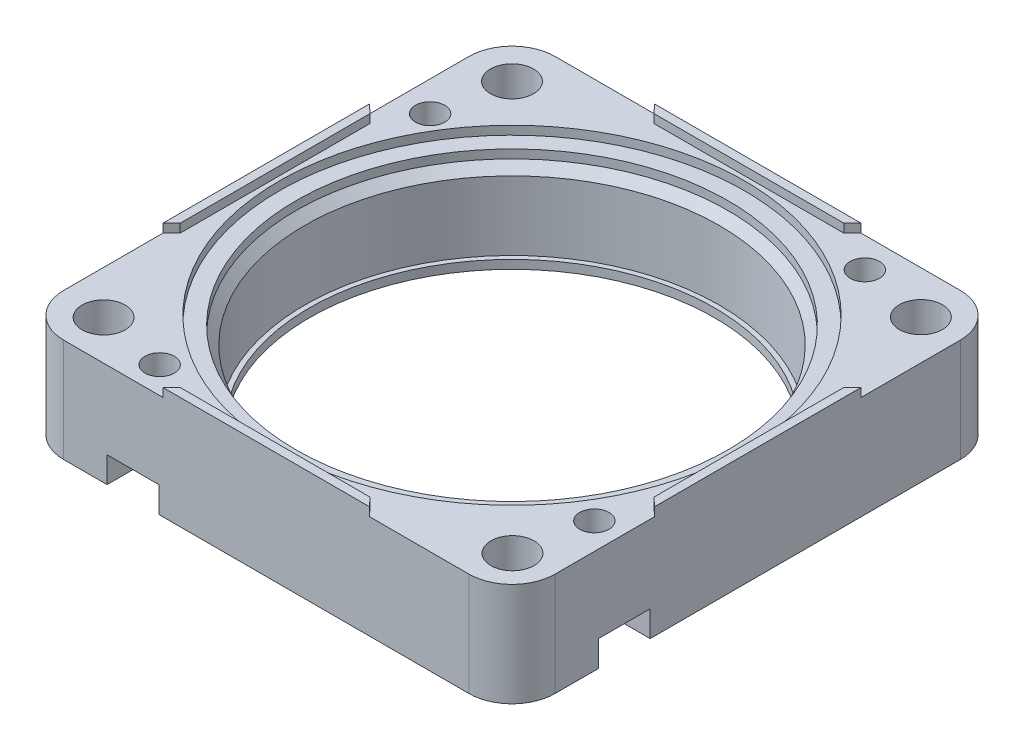
from build123d import *

# Parameters (mm, degrees)
SKETCH1_W           = 57
SKETCH1_H           = 57
BOSS_EXTRUDE1_DEPTH = 12
FILLET1_R           = 5
SKETCH2_R           = 2.5
SKETCH2_R_2         = 1.7
CUT_EXTRUDE1_DEPTH  = 43.053537307
CIRPATTERN2_COUNT   = 4
SKETCH3_R           = 27
CUT_EXTRUDE2_DEPTH  = 1
SKETCH4_R           = 25.05
CUT_EXTRUDE3_DEPTH  = 2
CHAMFER1_SIZE       = 1
SKETCH5_R           = 24.05
CUT_EXTRUDE4_DEPTH  = 8
SKETCH6_R           = 23.5
CUT_EXTRUDE5_DEPTH  = 2
BOSS_EXTRUDE2_DEPTH = 1
CIRPATTERN3_COUNT   = 4
CUT_EXTRUDE8_START  = -3
SKETCH9_R           = 3
SKETCH9_R_2         = 1.7
CUT_EXTRUDE8_DEPTH  = 3
CIRPATTERN6_COUNT   = 4


with BuildPart() as part:
    # Sketch1 → Boss-Extrude1 (new body)
    with BuildSketch(Plane(origin=(0, 0, 0), x_dir=(1, 0, 0), z_dir=(0, 1, 0))):
        Rectangle(SKETCH1_W, SKETCH1_H)
    extrude(amount=BOSS_EXTRUDE1_DEPTH)

    # Fillet1
    fillet1_edges = [part.edges().sort_by_distance(p)[0] for p in [
        (-28.5, 6, -28.5),
        (28.5, 6, -28.5),
        (28.5, 6, 28.5),
        (-28.5, 6, 28.5),
    ]]
    fillet(fillet1_edges, radius=FILLET1_R)

    # Sketch2 → Cut-Extrude1 (cut, through all)
    with BuildSketch(Plane(origin=(0, 12, 0), x_dir=(1, 0, 0), z_dir=(0, 1, 0))):
        with Locations(Location((-23.5, 23.5, 0), (0, 0, 270))):
            Circle(SKETCH2_R)
        with Locations(Location((-25, 15.5, 0), (0, 0, 270))):
            Circle(SKETCH2_R_2)
    cut_extrude1 = extrude(amount=-CUT_EXTRUDE1_DEPTH, mode=Mode.SUBTRACT)

    # CirPattern2: Cut-Extrude1 ×4 about axis
    cirpattern2_axis = Axis((0.215204442, 0, 0.188240663), (0, 1, 0))
    for i in range(1, CIRPATTERN2_COUNT):
        add(cut_extrude1.rotate(cirpattern2_axis, i * 360 / CIRPATTERN2_COUNT), mode=Mode.SUBTRACT)

    # Sketch3 → Cut-Extrude2 (cut)
    with BuildSketch(Plane(origin=(0, 12, 0), x_dir=(1, 0, 0), z_dir=(0, 1, 0))):
        with Locations(Location((0, 0, 0), (0, 0, 270))):
            Circle(SKETCH3_R)
    extrude(amount=-CUT_EXTRUDE2_DEPTH, mode=Mode.SUBTRACT)

    # Sketch4 → Cut-Extrude3 (cut)
    with BuildSketch(Plane(origin=(0, 11, 0), x_dir=(1, 0, 0), z_dir=(0, 1, 0))):
        with Locations(Location((0, 0, 0), (0, 0, 270))):
            Circle(SKETCH4_R)
    extrude(amount=-CUT_EXTRUDE3_DEPTH, mode=Mode.SUBTRACT)

    # Chamfer1
    chamfer1_edges = [part.edges().sort_by_distance(p)[0] for p in [
        (0, 9, -25.05),
    ]]
    chamfer(chamfer1_edges, length=CHAMFER1_SIZE)

    # Sketch5 → Cut-Extrude4 (cut)
    with BuildSketch(Plane(origin=(0, 9, 0), x_dir=(1, 0, 0), z_dir=(0, 1, 0))):
        with Locations(Location((0, 0, 0), (0, 0, 270))):
            Circle(SKETCH5_R)
    extrude(amount=-CUT_EXTRUDE4_DEPTH, mode=Mode.SUBTRACT)

    # Sketch6 → Cut-Extrude5 (cut)
    with BuildSketch(Plane(origin=(0, 1, 0), x_dir=(1, 0, 0), z_dir=(0, 1, 0))):
        with Locations(Location((0, 0, 0), (0, 0, 270))):
            Circle(SKETCH6_R)
    extrude(amount=-CUT_EXTRUDE5_DEPTH, mode=Mode.SUBTRACT)

    # Sketch7 → Boss-Extrude2 (add)
    with BuildSketch(Plane(origin=(0, 12, 0), x_dir=(1, 0, 0), z_dir=(0, 1, 0))):
        Polygon((27.5, 0), (27.5, -11), (28.5, -11.996579712), (28.5, 0), align=None)
        Polygon((27.5, 11), (27.5, 0), (28.5, 0), (28.5, 11.996579712), align=None)
    boss_extrude2 = extrude(amount=BOSS_EXTRUDE2_DEPTH)

    # CirPattern3: Boss-Extrude2 ×4 about axis
    cirpattern3_axis = Axis((0, 0, 0), (0, 1, 0))
    for i in range(1, CIRPATTERN3_COUNT):
        add(boss_extrude2.rotate(cirpattern3_axis, i * 360 / CIRPATTERN3_COUNT))

    # Sketch9 → Cut-Extrude8 (cut)
    # profile 1 of 3: a face of its own
    with BuildSketch(Plane.XZ.offset(CUT_EXTRUDE8_START)):
        with Locations((-15.473036222, 25.403445105)):
            Circle(SKETCH9_R)
        with Locations((-15.473036222, 25.403445105)):
            Circle(SKETCH9_R_2, mode=Mode.SUBTRACT)
    # profile 2 of 3: a face of its own
    with BuildSketch(Plane.XZ.offset(CUT_EXTRUDE8_START)):
        with BuildLine():
            ThreePointArc((-18.473036222, 25.403445105), (-15.473036222, 28.403445105), (-12.473036222, 25.403445105))
            Line((-12.473036222, 25.403445105), (-12.473036222, 28.424359567))
            Line((-12.473036222, 28.424359567), (-12.473036222, 28.5))
            Line((-12.473036222, 28.5), (-18.473036222, 28.5))
            Line((-18.473036222, 28.5), (-18.473036222, 25.403445105))
        make_face()
    # profile 3 of 3: a face of its own
    with BuildSketch(Plane.XZ.offset(CUT_EXTRUDE8_START)):
        with Locations((-15.473036222, 25.403445105)):
            Circle(SKETCH9_R_2)
    cut_extrude8 = extrude(amount=CUT_EXTRUDE8_DEPTH, mode=Mode.SUBTRACT)

    # CirPattern6: Cut-Extrude8 ×4 about axis
    cirpattern6_axis = Axis((0, 0, 0), (0, 1, 0))
    for i in range(1, CIRPATTERN6_COUNT):
        add(cut_extrude8.rotate(cirpattern6_axis, i * 360 / CIRPATTERN6_COUNT), mode=Mode.SUBTRACT)


solid = part.part
